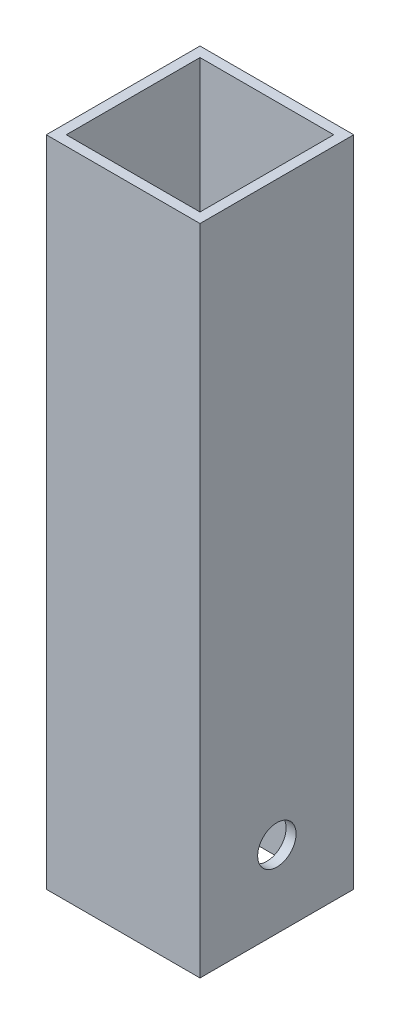
from build123d import *

# Parameters (mm, degrees)
SKETCH1_W           = 25.4
SKETCH1_H           = 25.4
BOSS_EXTRUDE1_DEPTH = 107.95
SKETCH2_W           = 22.098
SKETCH2_H           = 22.098
CUT_EXTRUDE1_DEPTH  = 114.769602707
SKETCH3_R           = 3.175
CUT_EXTRUDE2_DEPTH  = 114.769602707


with BuildPart() as part:
    # Sketch1 → Boss-Extrude1 (new body)
    with BuildSketch(Plane(origin=(0, 0, 0), x_dir=(1, 0, 0), z_dir=(0, 1, 0))):
        with Locations((12.7, -12.7)):
            Rectangle(SKETCH1_W, SKETCH1_H)
    extrude(amount=BOSS_EXTRUDE1_DEPTH)

    # Sketch2 → Cut-Extrude1 (cut, through all)
    with BuildSketch(Plane(origin=(0, 107.95, 0), x_dir=(1, 0, 0), z_dir=(0, 1, 0))):
        with Locations((12.7, -12.7)):
            Rectangle(SKETCH2_W, SKETCH2_H)
    extrude(amount=-CUT_EXTRUDE1_DEPTH, mode=Mode.SUBTRACT)

    # Sketch3 → Cut-Extrude2 (cut, through all)
    with BuildSketch(Plane.ZY):
        with Locations((12.7, 12.7)):
            Circle(SKETCH3_R)
    extrude(amount=-CUT_EXTRUDE2_DEPTH, mode=Mode.SUBTRACT)


solid = part.part
